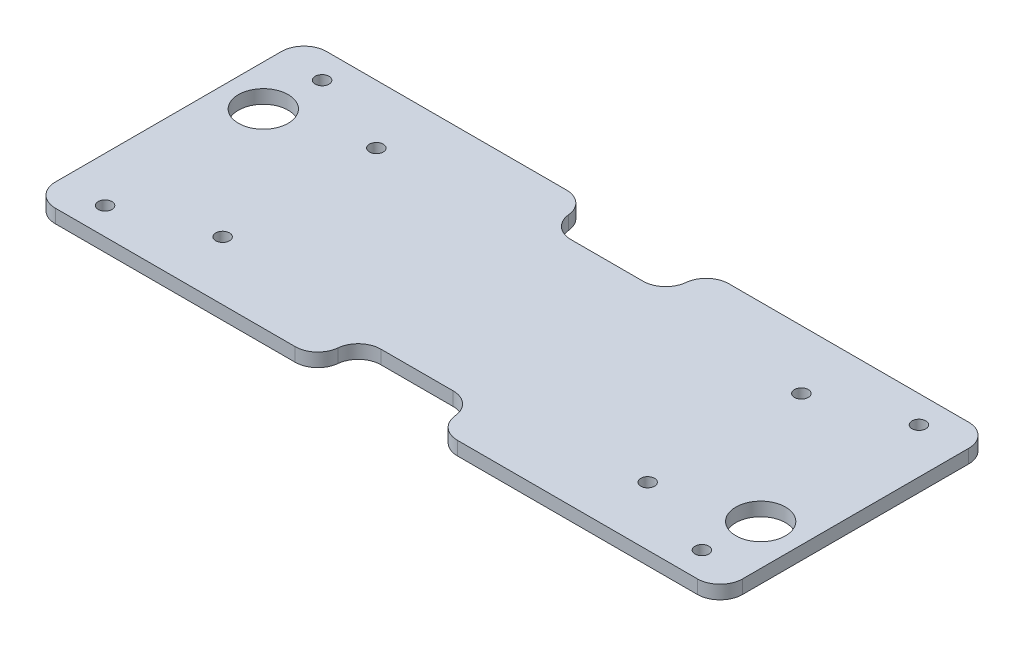
from build123d import *

# Parameters (mm, degrees)
SKETCH_1_W          = 152
SKETCH_1_H          = 60
EXTRUDE_1_DEPTH     = 3
FILLET_1_R          = 5
CUT_EXTRUDE_1_REACH = 83.762
SKETCH_2_R          = 1.525
CUT_EXTRUDE_2_REACH = 83.762
SKETCH_3_W          = 16
SKETCH_3_H          = 9
CUT_EXTRUDE_3_REACH = 83.762
SKETCH_4_R          = 1.525
CUT_EXTRUDE_4_REACH = 83.762
SKETCH_5_R          = 5.5


with BuildPart() as part:
    # 草图1 → 凸台-拉伸1 (new body)
    with BuildSketch(Plane(origin=(0, 0, 0), x_dir=(1, 0, 0), z_dir=(0, 1, 0))):
        Rectangle(SKETCH_1_W, SKETCH_1_H)
    extrude(amount=EXTRUDE_1_DEPTH)

    # 圆角1
    fillet_1_edges = [part.edges().sort_by_distance(p)[0] for p in [
        (76, 1.5, 30),
        (-76, 1.5, 30),
        (-76, 1.5, -30),
        (76, 1.5, -30),
    ]]
    fillet(fillet_1_edges, radius=FILLET_1_R)

    # 草图2 → 切除-拉伸1 (cut, up to next)
    with BuildSketch(Plane(origin=(0, 3, 0), x_dir=(1, 0, 0), z_dir=(0, 1, 0)), mode=Mode.PRIVATE) as cut_extrude_1_sk1:
        with Locations(Location((-66, -24, 0), (0, 0, 270))):
            Circle(SKETCH_2_R)
    cut_extrude_1_tool1 = extrude(cut_extrude_1_sk1.sketch, amount=-CUT_EXTRUDE_1_REACH, mode=Mode.PRIVATE) & part.part
    # 草图2 → 切除-拉伸1 (cut, up to next)
    with BuildSketch(Plane(origin=(0, 3, 0), x_dir=(1, 0, 0), z_dir=(0, 1, 0)), mode=Mode.PRIVATE) as cut_extrude_1_sk2:
        with Locations(Location((66, -24, 0), (0, 0, 270))):
            Circle(SKETCH_2_R)
    cut_extrude_1_tool2 = extrude(cut_extrude_1_sk2.sketch, amount=-CUT_EXTRUDE_1_REACH, mode=Mode.PRIVATE) & part.part
    # 草图2 → 切除-拉伸1 (cut, up to next)
    with BuildSketch(Plane(origin=(0, 3, 0), x_dir=(1, 0, 0), z_dir=(0, 1, 0)), mode=Mode.PRIVATE) as cut_extrude_1_sk3:
        with Locations(Location((66, 24, 0), (0, 0, 270))):
            Circle(SKETCH_2_R)
    cut_extrude_1_tool3 = extrude(cut_extrude_1_sk3.sketch, amount=-CUT_EXTRUDE_1_REACH, mode=Mode.PRIVATE) & part.part
    # 草图2 → 切除-拉伸1 (cut, up to next)
    with BuildSketch(Plane(origin=(0, 3, 0), x_dir=(1, 0, 0), z_dir=(0, 1, 0)), mode=Mode.PRIVATE) as cut_extrude_1_sk4:
        with Locations(Location((-66, 24, 0), (0, 0, 270))):
            Circle(SKETCH_2_R)
    cut_extrude_1_tool4 = extrude(cut_extrude_1_sk4.sketch, amount=-CUT_EXTRUDE_1_REACH, mode=Mode.PRIVATE) & part.part
    add(cut_extrude_1_tool1.solids().sort_by_distance((-66, 3, 24))[0], mode=Mode.SUBTRACT)
    add(cut_extrude_1_tool2.solids().sort_by_distance((66, 3, 24))[0], mode=Mode.SUBTRACT)
    add(cut_extrude_1_tool3.solids().sort_by_distance((66, 3, -24))[0], mode=Mode.SUBTRACT)
    add(cut_extrude_1_tool4.solids().sort_by_distance((-66, 3, -24))[0], mode=Mode.SUBTRACT)

    # 草图3 → 切除-拉伸2 (cut, up to next)
    with BuildSketch(Plane(origin=(0, 3, 0), x_dir=(1, 0, 0), z_dir=(0, 1, 0)), mode=Mode.PRIVATE) as cut_extrude_2_sk1:
        with BuildLine():
            Line((-8, -30), (-8, -21))
            ThreePointArc((-8, -21), (-11.354101966, -22.291900756), (-12.974937186, -25.5))
            ThreePointArc((-12.974937186, -25.5), (-14.595772405, -28.708099244), (-17.949874371, -30))
            Line((-17.949874371, -30), (-8, -30))
        make_face()
    cut_extrude_2_tool1 = extrude(cut_extrude_2_sk1.sketch, amount=-CUT_EXTRUDE_2_REACH, mode=Mode.PRIVATE) & part.part
    # 草图3 → 切除-拉伸2 (cut, up to next)
    with BuildSketch(Plane(origin=(0, 3, 0), x_dir=(1, 0, 0), z_dir=(0, 1, 0)), mode=Mode.PRIVATE) as cut_extrude_2_sk2:
        with Locations((0, -25.5)):
            Rectangle(SKETCH_3_W, SKETCH_3_H)
    cut_extrude_2_tool2 = extrude(cut_extrude_2_sk2.sketch, amount=-CUT_EXTRUDE_2_REACH, mode=Mode.PRIVATE) & part.part
    # 草图3 → 切除-拉伸2 (cut, up to next)
    with BuildSketch(Plane(origin=(0, 3, 0), x_dir=(1, 0, 0), z_dir=(0, 1, 0)), mode=Mode.PRIVATE) as cut_extrude_2_sk3:
        with BuildLine():
            ThreePointArc((12.974937186, -25.5), (11.354101966, -22.291900756), (8, -21))
            Line((8, -21), (8, -30))
            Line((8, -30), (17.949874371, -30))
            ThreePointArc((17.949874371, -30), (14.595772405, -28.708099244), (12.974937186, -25.5))
        make_face()
    cut_extrude_2_tool3 = extrude(cut_extrude_2_sk3.sketch, amount=-CUT_EXTRUDE_2_REACH, mode=Mode.PRIVATE) & part.part
    # 草图3 → 切除-拉伸2 (cut, up to next)
    with BuildSketch(Plane(origin=(0, 3, 0), x_dir=(1, 0, 0), z_dir=(0, 1, 0)), mode=Mode.PRIVATE) as cut_extrude_2_sk4:
        with BuildLine():
            ThreePointArc((-12.974937186, 25.5), (-11.354101966, 22.291900756), (-8, 21))
            Line((-8, 21), (-8, 30))
            Line((-8, 30), (-17.949874371, 30))
            ThreePointArc((-17.949874371, 30), (-14.595772405, 28.708099244), (-12.974937186, 25.5))
        make_face()
    cut_extrude_2_tool4 = extrude(cut_extrude_2_sk4.sketch, amount=-CUT_EXTRUDE_2_REACH, mode=Mode.PRIVATE) & part.part
    # 草图3 → 切除-拉伸2 (cut, up to next)
    with BuildSketch(Plane(origin=(0, 3, 0), x_dir=(1, 0, 0), z_dir=(0, 1, 0)), mode=Mode.PRIVATE) as cut_extrude_2_sk5:
        with Locations((0, 25.5)):
            Rectangle(SKETCH_3_W, SKETCH_3_H)
    cut_extrude_2_tool5 = extrude(cut_extrude_2_sk5.sketch, amount=-CUT_EXTRUDE_2_REACH, mode=Mode.PRIVATE) & part.part
    # 草图3 → 切除-拉伸2 (cut, up to next)
    with BuildSketch(Plane(origin=(0, 3, 0), x_dir=(1, 0, 0), z_dir=(0, 1, 0)), mode=Mode.PRIVATE) as cut_extrude_2_sk6:
        with BuildLine():
            Line((8, 30), (8, 21))
            ThreePointArc((8, 21), (11.354101966, 22.291900756), (12.974937186, 25.5))
            ThreePointArc((12.974937186, 25.5), (14.595772405, 28.708099244), (17.949874371, 30))
            Line((17.949874371, 30), (8, 30))
        make_face()
    cut_extrude_2_tool6 = extrude(cut_extrude_2_sk6.sketch, amount=-CUT_EXTRUDE_2_REACH, mode=Mode.PRIVATE) & part.part
    add(cut_extrude_2_tool1.solids().sort_by_distance((-10.749177, 3, 26.299455))[0], mode=Mode.SUBTRACT)
    add(cut_extrude_2_tool2.solids().sort_by_distance((0, 3, 25.5))[0], mode=Mode.SUBTRACT)
    add(cut_extrude_2_tool3.solids().sort_by_distance((10.749177, 3, 26.299455))[0], mode=Mode.SUBTRACT)
    add(cut_extrude_2_tool4.solids().sort_by_distance((-10.749177, 3, -26.299455))[0], mode=Mode.SUBTRACT)
    add(cut_extrude_2_tool5.solids().sort_by_distance((0, 3, -25.5))[0], mode=Mode.SUBTRACT)
    add(cut_extrude_2_tool6.solids().sort_by_distance((10.749177, 3, -26.299455))[0], mode=Mode.SUBTRACT)

    # 草图4 → 切除-拉伸3 (cut, up to next)
    with BuildSketch(Plane(origin=(0, 3, 0), x_dir=(1, 0, 0), z_dir=(0, 1, 0)), mode=Mode.PRIVATE) as cut_extrude_3_sk1:
        with Locations(Location((-47, -17, 0), (0, 0, 270))):
            Circle(SKETCH_4_R)
    cut_extrude_3_tool1 = extrude(cut_extrude_3_sk1.sketch, amount=-CUT_EXTRUDE_3_REACH, mode=Mode.PRIVATE) & part.part
    # 草图4 → 切除-拉伸3 (cut, up to next)
    with BuildSketch(Plane(origin=(0, 3, 0), x_dir=(1, 0, 0), z_dir=(0, 1, 0)), mode=Mode.PRIVATE) as cut_extrude_3_sk2:
        with Locations(Location((-47, 17, 0), (0, 0, 270))):
            Circle(SKETCH_4_R)
    cut_extrude_3_tool2 = extrude(cut_extrude_3_sk2.sketch, amount=-CUT_EXTRUDE_3_REACH, mode=Mode.PRIVATE) & part.part
    # 草图4 → 切除-拉伸3 (cut, up to next)
    with BuildSketch(Plane(origin=(0, 3, 0), x_dir=(1, 0, 0), z_dir=(0, 1, 0)), mode=Mode.PRIVATE) as cut_extrude_3_sk3:
        with Locations(Location((47, -17, 0), (0, 0, 270))):
            Circle(SKETCH_4_R)
    cut_extrude_3_tool3 = extrude(cut_extrude_3_sk3.sketch, amount=-CUT_EXTRUDE_3_REACH, mode=Mode.PRIVATE) & part.part
    # 草图4 → 切除-拉伸3 (cut, up to next)
    with BuildSketch(Plane(origin=(0, 3, 0), x_dir=(1, 0, 0), z_dir=(0, 1, 0)), mode=Mode.PRIVATE) as cut_extrude_3_sk4:
        with Locations(Location((47, 17, 0), (0, 0, 270))):
            Circle(SKETCH_4_R)
    cut_extrude_3_tool4 = extrude(cut_extrude_3_sk4.sketch, amount=-CUT_EXTRUDE_3_REACH, mode=Mode.PRIVATE) & part.part
    add(cut_extrude_3_tool1.solids().sort_by_distance((-47, 3, 17))[0], mode=Mode.SUBTRACT)
    add(cut_extrude_3_tool2.solids().sort_by_distance((-47, 3, -17))[0], mode=Mode.SUBTRACT)
    add(cut_extrude_3_tool3.solids().sort_by_distance((47, 3, 17))[0], mode=Mode.SUBTRACT)
    add(cut_extrude_3_tool4.solids().sort_by_distance((47, 3, -17))[0], mode=Mode.SUBTRACT)

    # 草图5 → 切除-拉伸4 (cut, up to next)
    with BuildSketch(Plane(origin=(0, 3, 0), x_dir=(1, 0, 0), z_dir=(0, 1, 0)), mode=Mode.PRIVATE) as cut_extrude_4_sk1:
        with Locations(Location((-67, 12, 0), (0, 0, 270))):
            Circle(SKETCH_5_R)
    cut_extrude_4_tool1 = extrude(cut_extrude_4_sk1.sketch, amount=-CUT_EXTRUDE_4_REACH, mode=Mode.PRIVATE) & part.part
    # 草图5 → 切除-拉伸4 (cut, up to next)
    with BuildSketch(Plane(origin=(0, 3, 0), x_dir=(1, 0, 0), z_dir=(0, 1, 0)), mode=Mode.PRIVATE) as cut_extrude_4_sk2:
        with Locations(Location((67, -12, 0), (0, 0, 270))):
            Circle(SKETCH_5_R)
    cut_extrude_4_tool2 = extrude(cut_extrude_4_sk2.sketch, amount=-CUT_EXTRUDE_4_REACH, mode=Mode.PRIVATE) & part.part
    add(cut_extrude_4_tool1.solids().sort_by_distance((-67, 3, -12))[0], mode=Mode.SUBTRACT)
    add(cut_extrude_4_tool2.solids().sort_by_distance((67, 3, 12))[0], mode=Mode.SUBTRACT)


solid = part.part
